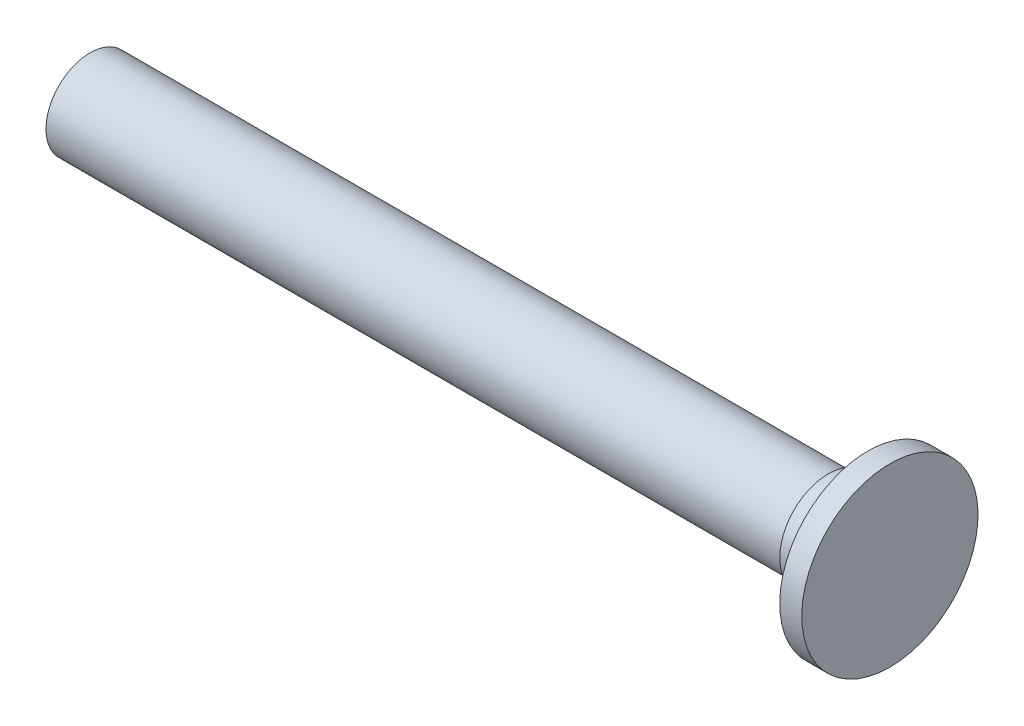
from build123d import *


with BuildPart() as part:
    # 草图1 → 旋转1 (revolve)
    with BuildSketch(Plane.XY, mode=Mode.PRIVATE) as revolve_1_sk:
        Polygon((0, 0), (0, 20), (-5, 20), (-5, 11), (-14, 11), (-14, 10), (-181.5, 10), (-181.5, 0), align=None)
    revolve(revolve_1_sk.sketch.rotate(Axis((68.028578159, 0, 0), (-1, 0, 0)), 180), axis=Axis((68.028578159, 0, 0), (-1, 0, 0)))


solid = part.part
